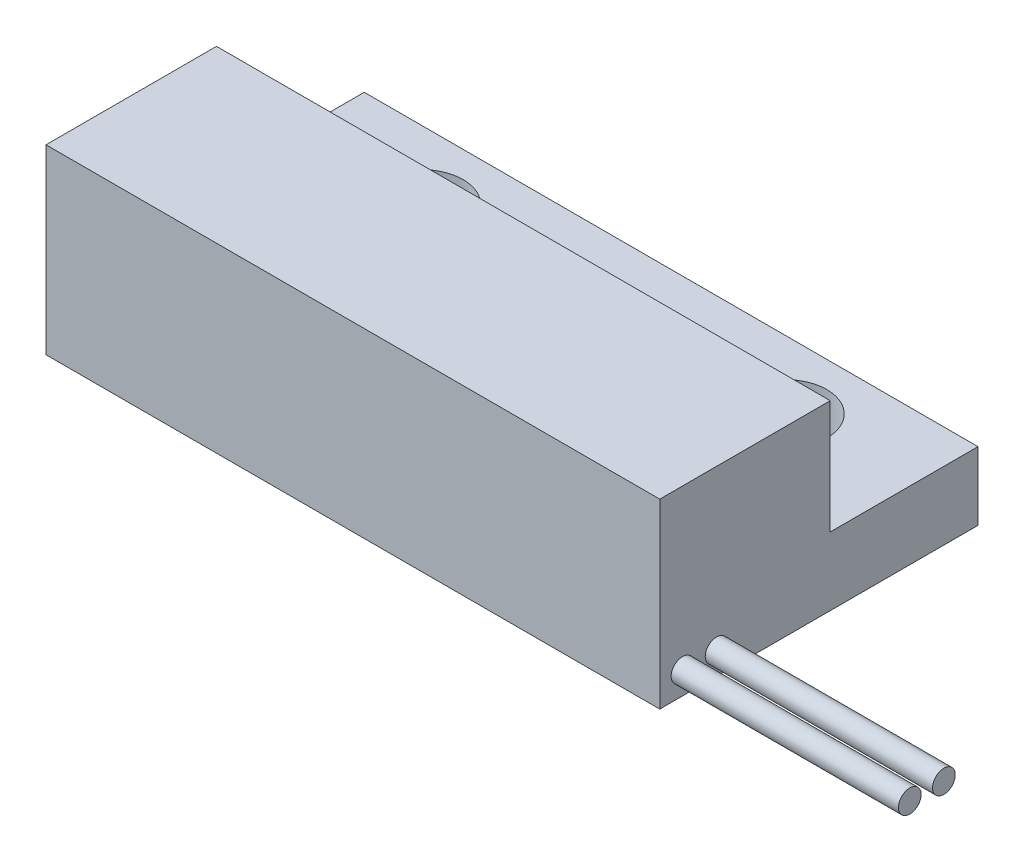
from build123d import *

# Parameters (mm, degrees)
CROQUIS1_W              = 27
CROQUIS1_H              = 14
CROQUIS1_R              = 1.85
SALIENTE_EXTRUIR1_DEPTH = 8
CROQUIS2_W              = 27
CROQUIS2_H              = 6.5
CORTAR_EXTRUIR1_DEPTH   = 5
CROQUIS3_R              = 0.5
SALIENTE_EXTRUIR2_DEPTH = 10


with BuildPart() as part:
    # Croquis1 → Saliente-Extruir1 (new body)
    with BuildSketch(Plane(origin=(0, 0, 0), x_dir=(1, 0, 0), z_dir=(0, 1, 0))):
        with Locations((-13.5, -7)):
            Rectangle(CROQUIS1_W, CROQUIS1_H)
        with Locations(Location((-21.5, -3, 0), (0, 0, 270))):
            Circle(CROQUIS1_R, mode=Mode.SUBTRACT)
        with Locations(Location((-5.5, -3, 0), (0, 0, 90))):
            Circle(CROQUIS1_R, mode=Mode.SUBTRACT)
    extrude(amount=SALIENTE_EXTRUIR1_DEPTH)

    # Croquis2 → Cortar-Extruir1 (cut)
    with BuildSketch(Plane(origin=(0, 8, 0), x_dir=(1, 0, 0), z_dir=(0, 1, 0))):
        with Locations((-13.5, -3.25)):
            Rectangle(CROQUIS2_W, CROQUIS2_H)
    extrude(amount=-CORTAR_EXTRUIR1_DEPTH, mode=Mode.SUBTRACT)

    # Croquis3 → Saliente-Extruir2 (add)
    with BuildSketch(Plane(origin=(0, 0, 0), x_dir=(0, 0, -1), z_dir=(1, 0, 0))):
        with Locations(Location((-13, 1, 0), (0, 0, 180))):
            Circle(CROQUIS3_R)
        with Locations(Location((-11.5, 1, 0), (0, 0, 180))):
            Circle(CROQUIS3_R)
    extrude(amount=SALIENTE_EXTRUIR2_DEPTH)


solid = part.part
